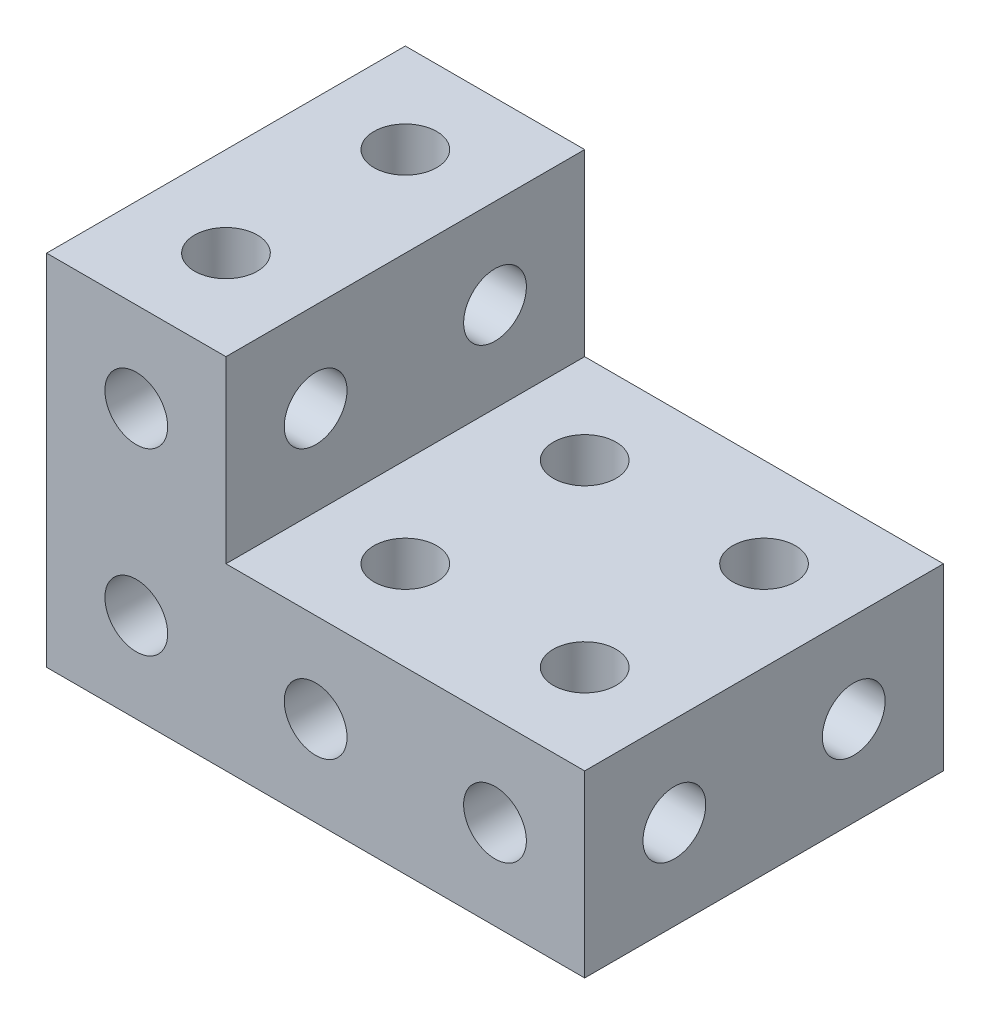
from build123d import *

# Parameters (mm, degrees)
BOSS_EXTRU_1_DEPTH      = 20
ESQUISSE2_R             = 1.75
ENL_V_MAT_EXTRU_1_DEPTH = 42.231056256
ESQUISSE3_R             = 1.75
ENL_V_MAT_EXTRU_2_DEPTH = 42.231056256
ESQUISSE4_R             = 1.75
ENL_V_MAT_EXTRU_3_DEPTH = 20


with BuildPart() as part:
    # Esquisse1 → Boss.-Extru.1 (new body)
    with BuildSketch(Plane.XY):
        Polygon((0, 0), (30, 0), (30, 10), (10, 10), (10, 20), (0, 20), align=None)
    extrude(amount=BOSS_EXTRU_1_DEPTH)

    # Esquisse2 → Enlèv. mat.-Extru.1 (cut, through all)
    with BuildSketch(Plane.XZ):
        with Locations(Location((5, 15, 0), (0, 0, 270))):
            Circle(ESQUISSE2_R)
        with Locations(Location((15, 15, 0), (0, 0, 270))):
            Circle(ESQUISSE2_R)
        with Locations(Location((25, 15, 0), (0, 0, 270))):
            Circle(ESQUISSE2_R)
        with Locations(Location((15, 5, 0), (0, 0, 270))):
            Circle(ESQUISSE2_R)
        with Locations(Location((25, 5, 0), (0, 0, 270))):
            Circle(ESQUISSE2_R)
        with Locations(Location((5, 5, 0), (0, 0, 270))):
            Circle(ESQUISSE2_R)
    extrude(amount=-ENL_V_MAT_EXTRU_1_DEPTH, mode=Mode.SUBTRACT)

    # Esquisse3 → Enlèv. mat.-Extru.2 (cut, through all)
    with BuildSketch(Plane.ZY):
        with Locations(Location((15, 5, 0), (0, 0, 180))):
            Circle(ESQUISSE3_R)
        with Locations(Location((5, 5, 0), (0, 0, 180))):
            Circle(ESQUISSE3_R)
        with Locations(Location((5, 15, 0), (0, 0, 270))):
            Circle(ESQUISSE3_R)
        with Locations(Location((15, 15, 0), (0, 0, 270))):
            Circle(ESQUISSE3_R)
    extrude(amount=-ENL_V_MAT_EXTRU_2_DEPTH, mode=Mode.SUBTRACT)

    # Esquisse4 → Enlèv. mat.-Extru.3 (cut)
    with BuildSketch(Plane.XY.offset(20)):
        with Locations((25, 5)):
            Circle(ESQUISSE4_R)
        with Locations(Location((15, 5, 0), (0, 0, 315))):
            Circle(ESQUISSE4_R)
        with Locations(Location((5, 5, 0), (0, 0, 315))):
            Circle(ESQUISSE4_R)
        with Locations((15, 15)):
            Circle(ESQUISSE4_R)
        with Locations(Location((5, 15, 0), (0, 0, 315))):
            Circle(ESQUISSE4_R)
        with Locations((25, 15)):
            Circle(ESQUISSE4_R)
    extrude(amount=-ENL_V_MAT_EXTRU_3_DEPTH, mode=Mode.SUBTRACT)


solid = part.part
